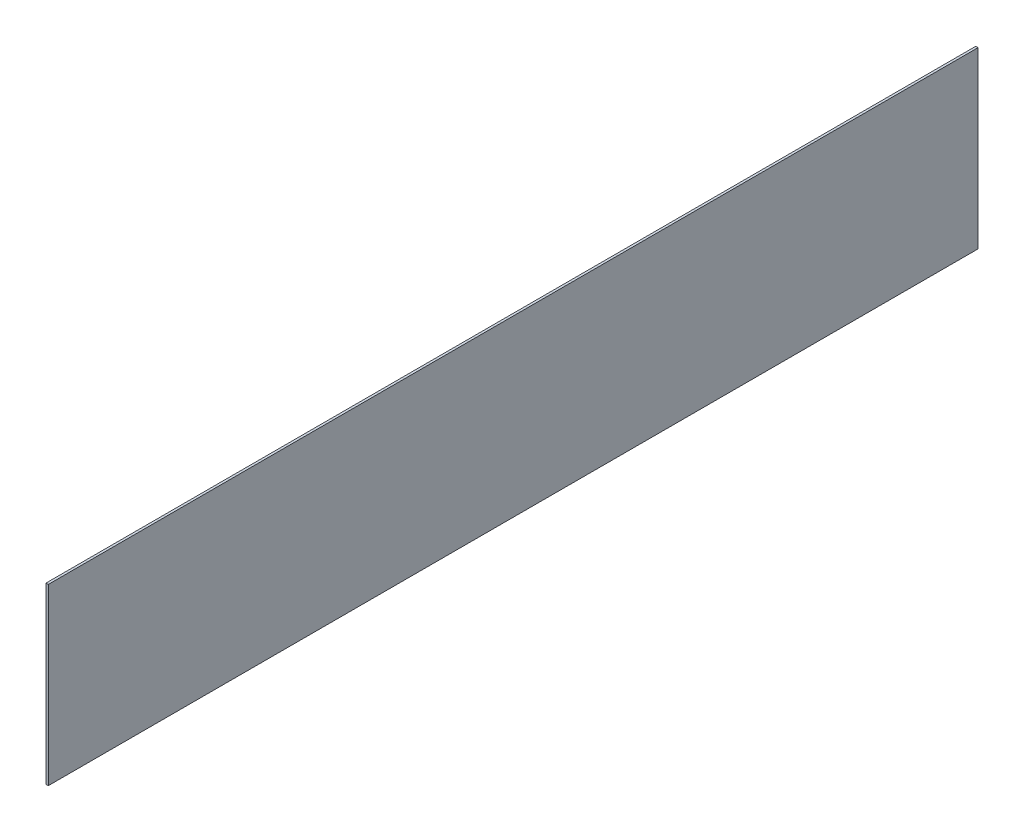
from build123d import *

# Parameters (mm, degrees)
SKETCH1_W           = 10
SKETCH1_H           = 750
BOSS_EXTRUDE1_DEPTH = 4000


with BuildPart() as part:
    # Sketch1 → Boss-Extrude1 (new body)
    with BuildSketch(Plane.XY):
        with Locations((-33.333333333, -82.5)):
            Rectangle(SKETCH1_W, SKETCH1_H)
    extrude(amount=BOSS_EXTRUDE1_DEPTH)


solid = part.part
